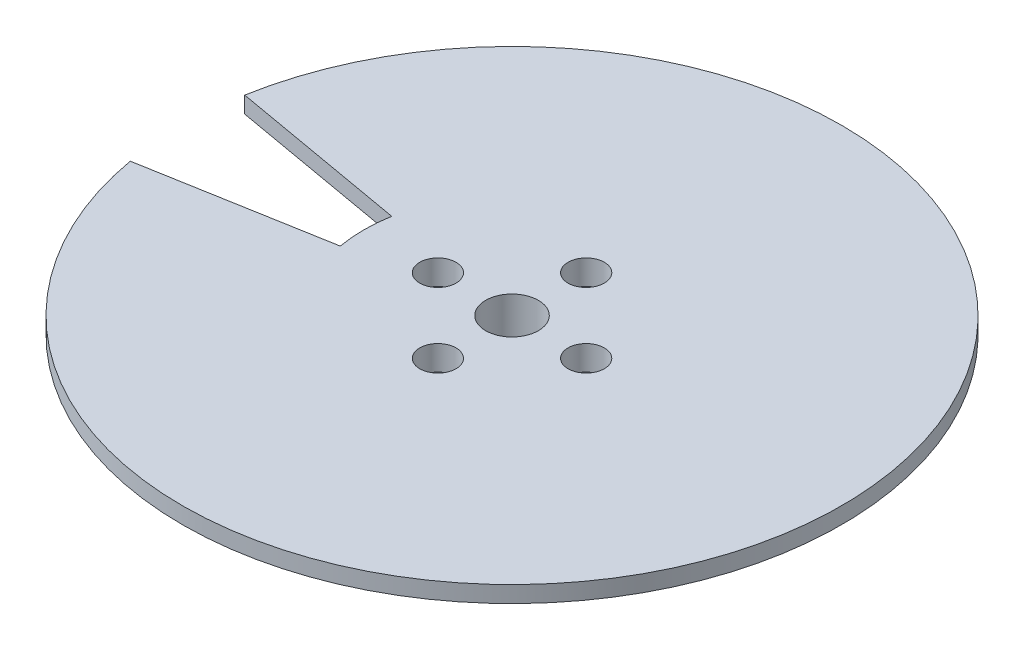
from build123d import *

# Parameters (mm, degrees)
SKETCH_1_R          = 9
SKETCH_1_R_2        = 7.5
EXTRUDE_1_DEPTH     = 6
EXTRUDE_START       = -1
EXTRUDE_2_DEPTH     = 1
EXTRUDE_3_DEPTH     = 3
EXTRUDE_START_2     = -3
SKETCH_5_R          = 7.5
EXTRUDE_4_DEPTH     = 3
SKETCH_6_R          = 1.6
CUT_EXTRUDE_1_DEPTH = 3
CHAMFER_1_SIZE      = 1
SKETCH_14_R         = 1.1
CUT_EXTRUDE_4_DEPTH = 1.5


with BuildPart() as part:
    # 草图1 → 凸台-拉伸1 (new body)
    with BuildSketch(Plane(origin=(0, 0, 0), x_dir=(1, 0, 0), z_dir=(0, 1, 0))):
        with Locations(Location((0, 0, 0), (0, 0, 270))):
            Circle(SKETCH_1_R)
        with Locations(Location((0, 0, 0), (0, 0, 270))):
            Circle(SKETCH_1_R_2, mode=Mode.SUBTRACT)
    extrude(amount=EXTRUDE_1_DEPTH)

    # 草图2 → 凸台-拉伸2 (add)
    with BuildSketch(Plane(origin=(0, 6, 0), x_dir=(1, 0, 0), z_dir=(0, 1, 0)).offset(EXTRUDE_START)):
        with BuildLine():
            Line((-19.69615506, 3.472963553), (-8.863269777, 1.562833599))
            ThreePointArc((-8.863269777, 1.562833599), (0.784401685, 8.965752283), (9, 0))
            ThreePointArc((9, 0), (0.784401685, -8.965752283), (-8.863269777, -1.562833599))
            Line((-8.863269777, -1.562833599), (-19.69615506, -3.472963553))
            ThreePointArc((-19.69615506, -3.472963553), (1.743114855, -19.923893962), (20, 0))
            ThreePointArc((20, 0), (1.743114855, 19.923893962), (-19.69615506, 3.472963553))
        make_face()
    extrude(amount=EXTRUDE_2_DEPTH)

    # 草图4 → 凸台-拉伸3 (add)
    with BuildSketch(Plane.XZ):
        with BuildLine():
            Line((0.856553191, 6.326082651), (0.856553191, 7.450927233))
            ThreePointArc((0.856553191, 7.450927233), (-0.043739259, 7.499872457), (-0.943399591, 7.440429908))
            Line((-0.943399591, 7.440429908), (-0.943399591, 6.312339741))
            Line((-0.943399591, 6.312339741), (-0.943399591, 5.418486616))
            ThreePointArc((-0.943399591, 5.418486616), (-0.044016518, 5.499823865), (0.856553191, 5.432892106))
            Line((0.856553191, 5.432892106), (0.856553191, 6.326082651))
        make_face()
        with BuildLine():
            Line((6.312339741, 0.943399591), (5.418486616, 0.943399591))
            ThreePointArc((5.418486616, 0.943399591), (5.499823865, 0.044016518), (5.432892106, -0.856553191))
            Line((5.432892106, -0.856553191), (6.326082651, -0.856553191))
            Line((6.326082651, -0.856553191), (7.450927233, -0.856553191))
            ThreePointArc((7.450927233, -0.856553191), (7.499872457, 0.043739259), (7.440429908, 0.943399591))
            Line((7.440429908, 0.943399591), (6.312339741, 0.943399591))
        make_face()
        with BuildLine():
            Line((0.943399591, -6.312339741), (0.943399591, -5.418486616))
            ThreePointArc((0.943399591, -5.418486616), (0.044016518, -5.499823865), (-0.856553191, -5.432892106))
            Line((-0.856553191, -5.432892106), (-0.856553191, -6.326082651))
            Line((-0.856553191, -6.326082651), (-0.856553191, -7.450927233))
            ThreePointArc((-0.856553191, -7.450927233), (0.043739259, -7.499872457), (0.943399591, -7.440429908))
            Line((0.943399591, -7.440429908), (0.943399591, -6.312339741))
        make_face()
        with BuildLine():
            Line((-6.312339741, -0.943399591), (-5.418486616, -0.943399591))
            ThreePointArc((-5.418486616, -0.943399591), (-5.499823865, -0.044016518), (-5.432892106, 0.856553191))
            Line((-5.432892106, 0.856553191), (-6.326082651, 0.856553191))
            Line((-6.326082651, 0.856553191), (-7.450927233, 0.856553191))
            ThreePointArc((-7.450927233, 0.856553191), (-7.499872457, -0.043739259), (-7.440429908, -0.943399591))
            Line((-7.440429908, -0.943399591), (-6.312339741, -0.943399591))
        make_face()
    extrude(amount=-EXTRUDE_3_DEPTH)

    # 草图5 → 凸台-拉伸4 (add)
    with BuildSketch(Plane(origin=(0, 6, 0), x_dir=(1, 0, 0), z_dir=(0, 1, 0)).offset(EXTRUDE_START_2)):
        Circle(SKETCH_5_R)
    extrude(amount=EXTRUDE_4_DEPTH)

    # 草图6 → 切除-拉伸1 (cut)
    with BuildSketch(Plane(origin=(0, 6, 0), x_dir=(1, 0, 0), z_dir=(0, 1, 0))):
        with Locations(Location((0, 0, 0), (0, 0, 270))):
            Circle(SKETCH_6_R)
    extrude(amount=-CUT_EXTRUDE_1_DEPTH, mode=Mode.SUBTRACT)

    # 倒角1
    chamfer_1_edges = [part.edges().sort_by_distance(p)[0] for p in [
        (0, 0, -9),
    ]]
    chamfer(chamfer_1_edges, length=CHAMFER_1_SIZE)

    # 草图14 → 切除-拉伸4 (cut)
    with BuildSketch(Plane(origin=(0, 6, 0), x_dir=(1, 0, 0), z_dir=(0, 1, 0))):
        with Locations(Location((0, 4.5, 0), (0, 0, 270))):
            Circle(SKETCH_14_R)
        with Locations(Location((4.5, 0, 0), (0, 0, 270))):
            Circle(SKETCH_14_R)
        with Locations(Location((0, -4.5, 0), (0, 0, 270))):
            Circle(SKETCH_14_R)
        with Locations(Location((-4.5, 0, 0), (0, 0, 270))):
            Circle(SKETCH_14_R)
    extrude(amount=-CUT_EXTRUDE_4_DEPTH, mode=Mode.SUBTRACT)


solid = part.part
